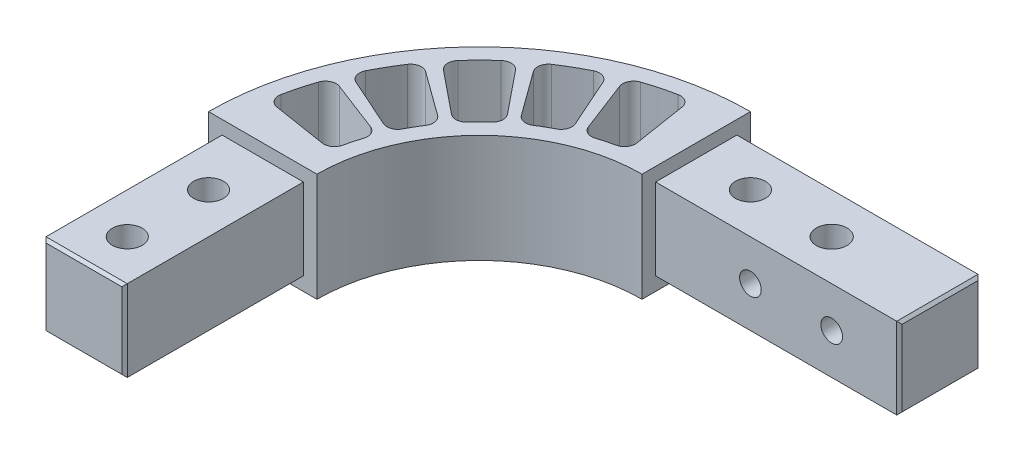
from build123d import *

# Parameters (mm, degrees)
BOSS_EXTRUDE1_DEPTH = 20
SKETCH2_W           = 15
SKETCH2_H           = 15
BOSS_EXTRUDE2_DEPTH = 33
SKETCH3_W           = 15
SKETCH3_H           = 15
BOSS_EXTRUDE3_DEPTH = 45
SKETCH4_R           = 2.75
SKETCH4_R_2         = 2.825
CUT_EXTRUDE1_DEPTH  = 73.844011422
CUT_EXTRUDE2_DEPTH  = 74.484692283
CHAMFER1_SIZE       = 0.5
SKETCH6_R           = 2
CUT_EXTRUDE3_DEPTH  = 20


with BuildPart() as part:
    # Sketch1 → Boss-Extrude1 (new body)
    with BuildSketch(Plane(origin=(0, 0, 0), x_dir=(1, 0, 0), z_dir=(0, 1, 0))):
        with BuildLine():
            Line((0, 50), (0, 30))
            ThreePointArc((0, 30), (-21.213203436, 21.213203436), (-30, 0))
            Line((-30, 0), (-50, 0))
            ThreePointArc((-50, 0), (-35.355339059, 35.355339059), (0, 50))
        make_face()
    extrude(amount=BOSS_EXTRUDE1_DEPTH)

    # Sketch2 → Boss-Extrude2 (add)
    with BuildSketch(Plane.XY):
        with Locations((-40, 10)):
            Rectangle(SKETCH2_W, SKETCH2_H)
    extrude(amount=BOSS_EXTRUDE2_DEPTH)

    # Sketch3 → Boss-Extrude3 (add)
    with BuildSketch(Plane(origin=(0, 0, 0), x_dir=(0, 0, -1), z_dir=(1, 0, 0))):
        with Locations((40, 10)):
            Rectangle(SKETCH3_W, SKETCH3_H)
    extrude(amount=BOSS_EXTRUDE3_DEPTH)

    # Sketch4 → Cut-Extrude1 (cut, through all)
    with BuildSketch(Plane(origin=(0, 17.5, 0), x_dir=(1, 0, 0), z_dir=(0, 1, 0))):
        with Locations(Location((10, 40, 0), (0, 0, 270))):
            Circle(SKETCH4_R)
        with Locations(Location((25, 40, 0), (0, 0, 270))):
            Circle(SKETCH4_R_2)
        with Locations(Location((-40, -10, 0), (0, 0, 270))):
            Circle(SKETCH4_R)
        with Locations(Location((-40, -25, 0), (0, 0, 270))):
            Circle(SKETCH4_R)
    extrude(amount=-CUT_EXTRUDE1_DEPTH, mode=Mode.SUBTRACT)

    # Sketch5 → Cut-Extrude2 (cut, through all)
    with BuildSketch(Plane(origin=(0, 20, 0), x_dir=(1, 0, 0), z_dir=(0, 1, 0))):
        with BuildLine():
            Line((-21.990223117, 27.155663999), (-28.291433976, 34.937011371))
            ThreePointArc((-28.291433976, 34.937011371), (-29.68093252, 35.671569812), (-31.172202606, 35.17518706))
            ThreePointArc((-31.172202606, 35.17518706), (-33.234018716, 33.234018716), (-35.17518706, 31.172202606))
            ThreePointArc((-35.17518706, 31.172202606), (-35.671569812, 29.68093252), (-34.937011371, 28.291433976))
            Line((-34.937011371, 28.291433976), (-27.155663999, 21.990223117))
            ThreePointArc((-27.155663999, 21.990223117), (-25.744904759, 21.550308438), (-24.417193319, 22.199114181))
            ThreePointArc((-24.417193319, 22.199114181), (-23.334523779, 23.334523779), (-22.199114181, 24.417193319))
            ThreePointArc((-22.199114181, 24.417193319), (-21.550308438, 25.744904759), (-21.990223117, 27.155663999))
        make_face()
        with BuildLine():
            Line((-20.538868638, 28.26932746), (-26.424199651, 36.369790662))
            ThreePointArc((-26.424199651, 36.369790662), (-26.774099933, 37.902060905), (-25.908661914, 39.214043885))
            ThreePointArc((-25.908661914, 39.214043885), (-23.5, 40.703193978), (-21.006027233, 42.044581338))
            ThreePointArc((-21.006027233, 42.044581338), (-19.437097633, 42.138081158), (-18.285062818, 41.068923503))
            Line((-18.285062818, 41.068923503), (-14.21252141, 31.921845736))
            ThreePointArc((-14.21252141, 31.921845736), (-14.152727818, 30.445298653), (-15.123063049, 29.330751167))
            ThreePointArc((-15.123063049, 29.330751167), (-16.5, 28.578838325), (-17.839644098, 27.762332367))
            ThreePointArc((-17.839644098, 27.762332367), (-19.290038151, 27.47927115), (-20.538868638, 28.26932746))
        make_face()
        with BuildLine():
            Line((-12.522383321, 32.621923854), (-16.110622392, 41.969606219))
            ThreePointArc((-16.110622392, 41.969606219), (-16.05201939, 43.540226476), (-14.876504274, 44.583512878))
            ThreePointArc((-14.876504274, 44.583512878), (-12.16449512, 45.398513836), (-9.408325818, 46.04870688))
            ThreePointArc((-9.408325818, 46.04870688), (-7.868656664, 45.73295191), (-7.032594847, 44.402056368))
            Line((-7.032594847, 44.402056368), (-5.466259855, 34.512606439))
            ThreePointArc((-5.466259855, 34.512606439), (-5.790662187, 33.070895758), (-7.016400163, 32.245466794))
            ThreePointArc((-7.016400163, 32.245466794), (-8.541028488, 31.875552268), (-10.046352613, 31.433593482))
            ThreePointArc((-10.046352613, 31.433593482), (-11.52058732, 31.535566946), (-12.522383321, 32.621923854))
        make_face()
        with BuildLine():
            Line((-31.921845736, 14.21252141), (-41.068923503, 18.285062818))
            ThreePointArc((-41.068923503, 18.285062818), (-42.138081158, 19.437097633), (-42.044581338, 21.006027233))
            ThreePointArc((-42.044581338, 21.006027233), (-40.703193978, 23.5), (-39.214043885, 25.908661914))
            ThreePointArc((-39.214043885, 25.908661914), (-37.902060905, 26.774099933), (-36.369790662, 26.424199651))
            Line((-36.369790662, 26.424199651), (-28.26932746, 20.538868638))
            ThreePointArc((-28.26932746, 20.538868638), (-27.47927115, 19.290038151), (-27.762332367, 17.839644098))
            ThreePointArc((-27.762332367, 17.839644098), (-28.578838325, 16.5), (-29.330751167, 15.123063049))
            ThreePointArc((-29.330751167, 15.123063049), (-30.445298653, 14.152727818), (-31.921845736, 14.21252141))
        make_face()
        with BuildLine():
            Line((-34.512606439, 5.466259855), (-44.402056368, 7.032594847))
            ThreePointArc((-44.402056368, 7.032594847), (-45.73295191, 7.868656664), (-46.04870688, 9.408325818))
            ThreePointArc((-46.04870688, 9.408325818), (-45.398513836, 12.16449512), (-44.583512878, 14.876504274))
            ThreePointArc((-44.583512878, 14.876504274), (-43.540226476, 16.05201939), (-41.969606219, 16.110622392))
            Line((-41.969606219, 16.110622392), (-32.621923854, 12.522383321))
            ThreePointArc((-32.621923854, 12.522383321), (-31.535566946, 11.52058732), (-31.433593482, 10.046352613))
            ThreePointArc((-31.433593482, 10.046352613), (-31.875552268, 8.541028488), (-32.245466794, 7.016400163))
            ThreePointArc((-32.245466794, 7.016400163), (-33.070895758, 5.790662187), (-34.512606439, 5.466259855))
        make_face()
    extrude(amount=-CUT_EXTRUDE2_DEPTH, mode=Mode.SUBTRACT)

    # Chamfer1
    chamfer1_edges = [part.edges().sort_by_distance(p)[0] for p in [
        (-32.5, 10, 33),
        (-40, 17.5, 33),
        (-47.5, 10, 33),
        (-40, 2.5, 33),
        (45, 10, -47.5),
        (45, 17.5, -40),
        (45, 10, -32.5),
        (45, 2.5, -40),
    ]]
    chamfer(chamfer1_edges, length=CHAMFER1_SIZE)

    # Sketch6 → Cut-Extrude3 (cut)
    with BuildSketch(Plane(origin=(0, 0, -47.5), x_dir=(-1, 0, 0), z_dir=(0, 0, -1))):
        with Locations((-17.5, 10)):
            Circle(SKETCH6_R)
        with Locations((-32.5, 10)):
            Circle(SKETCH6_R)
    extrude(amount=-CUT_EXTRUDE3_DEPTH, mode=Mode.SUBTRACT)


solid = part.part
